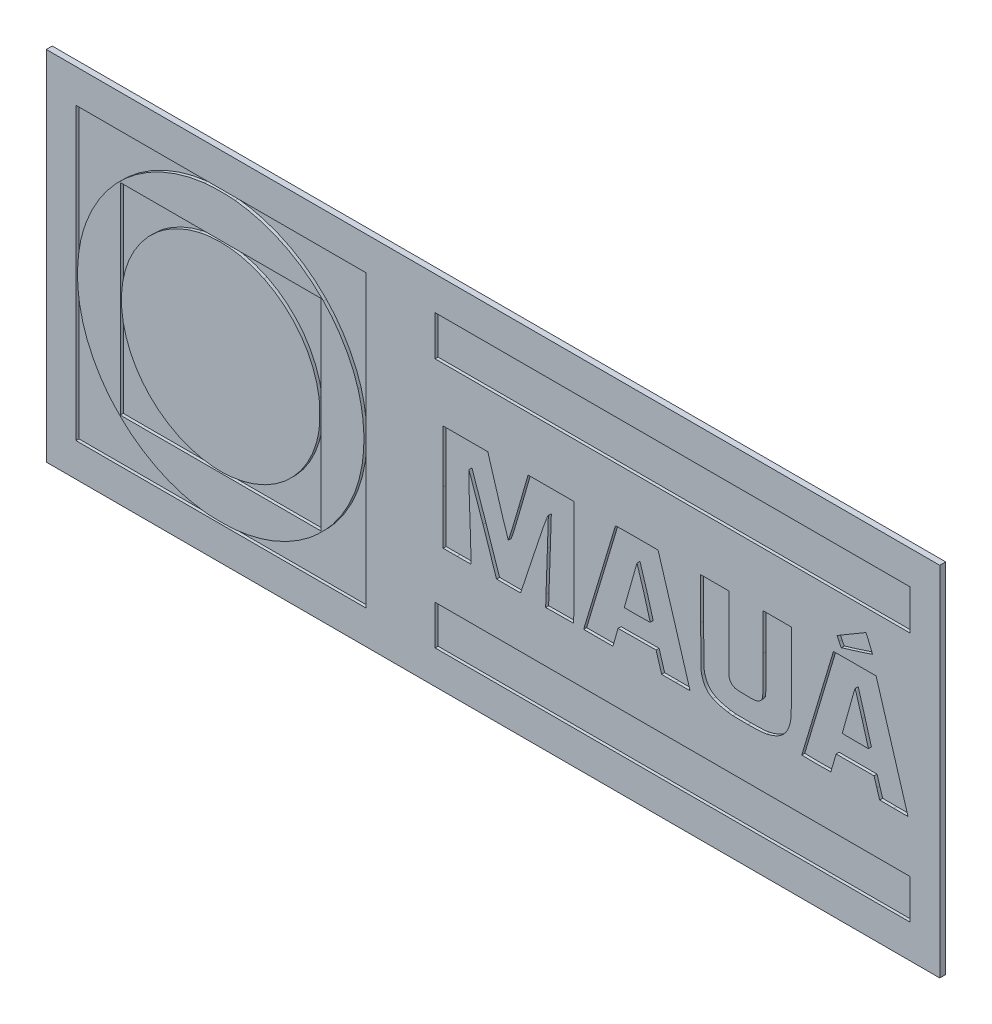
from build123d import *

# Parameters (mm, degrees)
SKETCH2_W           = 150
SKETCH2_H           = 60
BOSS_EXTRUDE1_DEPTH = 1
CUT_EXTRUDE1_DEPTH  = 0.5


with BuildPart() as part:
    # Sketch2 → Boss-Extrude1 (new body)
    with BuildSketch(Plane.XY):
        Rectangle(SKETCH2_W, SKETCH2_H)
    extrude(amount=-BOSS_EXTRUDE1_DEPTH)

    # Model → Cut-Extrude1 (cut)
    # profile 1 of 9: a face of its own
    with BuildSketch(Plane.XY):
        Polygon((-69.999501, 0.0001), (-69.999501, 24.373671), (-45.665422, 24.373671), (-21.331363, 24.373671), (-21.331363, 0.0001), (-21.331363, -24.373478), (-45.665422, -24.373478), (-69.999501, -24.373478), align=None)
        with BuildLine():
            add(Edge.make_bspline(
                [(-43.441856, -23.976498), (-38.737075, -23.511734), (-34.41055, -21.750496), (-30.68278, -18.782646)],
                knots=[0, 0, 0, 0, 1, 1, 1, 1], degree=3))
            add(Edge.make_bspline(
                [(-30.68278, -18.782646), (-29.615329, -17.932805), (-27.811508, -16.135746), (-26.977898, -15.091663)],
                knots=[0, 0, 0, 0, 1, 1, 1, 1], degree=3))
            add(Edge.make_bspline(
                [(-26.977898, -15.091663), (-22.016527, -8.877577), (-20.427734, -0.852189), (-22.64688, 6.785351)],
                knots=[0, 0, 0, 0, 1, 1, 1, 1], degree=3))
            add(Edge.make_bspline(
                [(-22.64688, 6.785351), (-23.67956, 10.339459), (-25.776242, 13.906376), (-28.467317, 16.687166)],
                knots=[0, 0, 0, 0, 1, 1, 1, 1], degree=3))
            add(Edge.make_bspline(
                [(-28.467317, 16.687166), (-32.418872, 20.770453), (-37.560455, 23.273732), (-43.295225, 23.906398)],
                knots=[0, 0, 0, 0, 1, 1, 1, 1], degree=3))
            add(Edge.make_bspline(
                [(-43.295225, 23.906398), (-44.51303, 24.040753), (-47.160051, 24.018525), (-48.470168, 23.86301)],
                knots=[0, 0, 0, 0, 1, 1, 1, 1], degree=3))
            add(Edge.make_bspline(
                [(-48.470168, 23.86301), (-55.755439, 22.997911), (-62.204067, 18.901758), (-66.136774, 12.641225)],
                knots=[0, 0, 0, 0, 1, 1, 1, 1], degree=3))
            add(Edge.make_bspline(
                [(-66.136774, 12.641225), (-67.547414, 10.395595), (-68.635085, 7.754055), (-69.210976, 5.175086)],
                knots=[0, 0, 0, 0, 1, 1, 1, 1], degree=3))
            add(Edge.make_bspline(
                [(-69.210976, 5.175086), (-69.851931, 2.304802), (-69.935669, -1.146762), (-69.435244, -4.068698)],
                knots=[0, 0, 0, 0, 1, 1, 1, 1], degree=3))
            add(Edge.make_bspline(
                [(-69.435244, -4.068698), (-68.755604, -8.03704), (-67.074459, -11.781229), (-64.529268, -14.995158)],
                knots=[0, 0, 0, 0, 1, 1, 1, 1], degree=3))
            add(Edge.make_bspline(
                [(-64.529268, -14.995158), (-63.730773, -16.003465), (-61.747419, -17.99231), (-60.755715, -18.779165)],
                knots=[0, 0, 0, 0, 1, 1, 1, 1], degree=3))
            add(Edge.make_bspline(
                [(-60.755715, -18.779165), (-57.17894, -21.617121), (-52.952281, -23.40521), (-48.667691, -23.89301)],
                knots=[0, 0, 0, 0, 1, 1, 1, 1], degree=3))
            add(Edge.make_bspline(
                [(-48.667691, -23.89301), (-48.254867, -23.940036), (-47.810455, -23.990891), (-47.680093, -24.006093)],
                knots=[0, 0, 0, 0, 1, 1, 1, 1], degree=3))
            add(Edge.make_bspline(
                [(-47.680093, -24.006093), (-47.12223, -24.071135), (-44.192335, -24.050699), (-43.441856, -23.976498)],
                knots=[0, 0, 0, 0, 1, 1, 1, 1], degree=3))
        make_face(mode=Mode.SUBTRACT)
    # profile 2 of 9: a face of its own
    with BuildSketch(Plane.XY):
        Polygon((-62.572862, -0.039402), (-62.572862, 16.868036), (-45.704934, 16.868036), (-28.836996, 16.868036), (-28.836996, -0.039402), (-28.836996, -16.946842), (-45.704934, -16.946842), (-62.572862, -16.946842), align=None)
        with BuildLine():
            add(Edge.make_bspline(
                [(-44.073449, -16.627499), (-36.462378, -15.861637), (-30.251039, -9.894933), (-29.196791, -2.336327)],
                knots=[0, 0, 0, 0, 1, 1, 1, 1], degree=3))
            add(Edge.make_bspline(
                [(-29.196791, -2.336327), (-29.039388, -1.207816), (-29.037248, 1.143196), (-29.192158, 2.236272)],
                knots=[0, 0, 0, 0, 1, 1, 1, 1], degree=3))
            add(Edge.make_bspline(
                [(-29.192158, 2.236272), (-29.97801, 7.764711), (-33.411974, 12.483206), (-38.435841, 14.937696)],
                knots=[0, 0, 0, 0, 1, 1, 1, 1], degree=3))
            add(Edge.make_bspline(
                [(-38.435841, 14.937696), (-41.834586, 16.598202), (-45.608449, 17.047045), (-49.338766, 16.234438)],
                knots=[0, 0, 0, 0, 1, 1, 1, 1], degree=3))
            add(Edge.make_bspline(
                [(-49.338766, 16.234438), (-51.740042, 15.711351), (-54.418537, 14.396102), (-56.322917, 12.804947)],
                knots=[0, 0, 0, 0, 1, 1, 1, 1], degree=3))
            add(Edge.make_bspline(
                [(-56.322917, 12.804947), (-63.816385, 6.543971), (-64.452115, -4.559637), (-57.71823, -11.565325)],
                knots=[0, 0, 0, 0, 1, 1, 1, 1], degree=3))
            add(Edge.make_bspline(
                [(-57.71823, -11.565325), (-54.173203, -15.253437), (-49.104918, -17.13375), (-44.073449, -16.627499)],
                knots=[0, 0, 0, 0, 1, 1, 1, 1], degree=3))
        make_face(mode=Mode.SUBTRACT)
    # profile 3 of 9: a face of its own
    with BuildSketch(Plane.XY):
        Polygon((-9.717374, -21.055195), (-9.717374, -17.736912), (30.141512, -17.736912), (70.000392, -17.736912), (70.000392, -21.055195), (70.000392, -24.373478), (30.141512, -24.373478), (-9.717374, -24.373478), align=None)
    # profile 4 of 9: a face of its own
    with BuildSketch(Plane.XY):
        with BuildLine():
            Line((34.860914, 1.599985), (34.835252, 8.572331))
            Line((34.835252, 8.572331), (37.209044, 8.572331))
            Line((37.209044, 8.572331), (39.582849, 8.572331))
            Line((39.582849, 8.572331), (39.582849, 2.382098))
            add(Edge.make_bspline(
                [(39.582849, 2.382098), (39.582849, -2.084243), (39.608227, -3.882934), (39.673922, -4.076705)],
                knots=[0, 0, 0, 0, 1, 1, 1, 1], degree=3))
            add(Edge.make_bspline(
                [(39.673922, -4.076705), (39.820819, -4.509806), (40.033115, -4.754072), (40.432708, -4.949759)],
                knots=[0, 0, 0, 0, 1, 1, 1, 1], degree=3))
            add(Edge.make_bspline(
                [(40.432708, -4.949759), (40.776915, -5.118322), (40.930521, -5.135624), (42.31933, -5.162265)],
                knots=[0, 0, 0, 0, 1, 1, 1, 1], degree=3))
            add(Edge.make_bspline(
                [(42.31933, -5.162265), (43.536587, -5.185633), (43.916022, -5.166898), (44.266356, -5.064777)],
                knots=[0, 0, 0, 0, 1, 1, 1, 1], degree=3))
            add(Edge.make_bspline(
                [(44.266356, -5.064777), (44.769, -4.918657), (45.135838, -4.561381), (45.266562, -4.090658)],
                knots=[0, 0, 0, 0, 1, 1, 1, 1], degree=3))
            add(Edge.make_bspline(
                [(45.266562, -4.090658), (45.321156, -3.894175), (45.349617, -1.680196), (45.349898, 2.390055)],
                knots=[0, 0, 0, 0, 1, 1, 1, 1], degree=3))
            Line((45.349898, 2.390055), (45.350149, 8.572331))
            Line((45.350149, 8.572331), (47.720346, 8.572331))
            Line((47.720346, 8.572331), (50.090549, 8.572331))
            Line((50.090549, 8.572331), (50.090549, 2.10413))
            add(Edge.make_bspline(
                [(50.090549, 2.10413), (50.090549, -3.294732), (50.070953, -4.476587), (49.971868, -5.044622)],
                knots=[0, 0, 0, 0, 1, 1, 1, 1], degree=3))
            add(Edge.make_bspline(
                [(49.971868, -5.044622), (49.570122, -7.348474), (48.398897, -8.512367), (45.941392, -9.049897)],
                knots=[0, 0, 0, 0, 1, 1, 1, 1], degree=3))
            add(Edge.make_bspline(
                [(45.941392, -9.049897), (45.249089, -9.201331), (44.867625, -9.225329), (42.821938, -9.246235)],
                knots=[0, 0, 0, 0, 1, 1, 1, 1], degree=3))
            add(Edge.make_bspline(
                [(42.821938, -9.246235), (41.540048, -9.259324), (40.402353, -9.255603), (40.29372, -9.236868)],
                knots=[0, 0, 0, 0, 1, 1, 1, 1], degree=3))
            add(Edge.make_bspline(
                [(40.29372, -9.236868), (40.185239, -9.21928), (39.776377, -9.16492), (39.385296, -9.116405)],
                knots=[0, 0, 0, 0, 1, 1, 1, 1], degree=3))
            add(Edge.make_bspline(
                [(39.385296, -9.116405), (38.507366, -9.007496), (37.516175, -8.72689), (36.886268, -8.408911)],
                knots=[0, 0, 0, 0, 1, 1, 1, 1], degree=3))
            add(Edge.make_bspline(
                [(36.886268, -8.408911), (35.942195, -7.932339), (35.406578, -7.22279), (35.060087, -5.989708)],
                knots=[0, 0, 0, 0, 1, 1, 1, 1], degree=3))
            add(Edge.make_bspline(
                [(35.060087, -5.989708), (34.888413, -5.378746), (34.886344, -5.300149), (34.860914, 1.599985)],
                knots=[0, 0, 0, 0, 1, 1, 1, 1], degree=3))
        make_face()
    # profile 5 of 9: a face of its own
    with BuildSketch(Plane.XY):
        with BuildLine():
            Line((-8.374267, -0.315929), (-8.374267, 8.572331))
            Line((-8.374267, 8.572331), (-4.625173, 8.572331))
            Line((-4.625173, 8.572331), (-0.87609, 8.572331))
            Line((-0.87609, 8.572331), (-0.716555, 8.039038))
            add(Edge.make_bspline(
                [(-0.716555, 8.039038), (1.260565, 1.429938), (2.499683, -2.56762), (2.571185, -2.56762)],
                knots=[0, 0, 0, 0, 1, 1, 1, 1], degree=3))
            add(Edge.make_bspline(
                [(2.571185, -2.56762), (2.621759, -2.56762), (3.361339, -0.145391), (4.271842, 3.002351)],
                knots=[0, 0, 0, 0, 1, 1, 1, 1], degree=3))
            Line((4.271842, 3.002351), (5.883005, 8.572331))
            Line((5.883005, 8.572331), (9.736639, 8.572331))
            Line((9.736639, 8.572331), (13.59028, 8.572331))
            Line((13.59028, 8.572331), (13.570229, -0.296177))
            Line((13.570229, -0.296177), (13.550178, -9.164674))
            Line((13.550178, -9.164674), (11.193141, -9.185561))
            Line((11.193141, -9.185561), (8.836108, -9.206447))
            Line((8.836108, -9.206447), (8.897414, -7.249849))
            add(Edge.make_bspline(
                [(8.897414, -7.249849), (8.931192, -6.173712), (9.036447, -3.124513), (9.131393, -0.473831)],
                knots=[0, 0, 0, 0, 1, 1, 1, 1], degree=3))
            add(Edge.make_bspline(
                [(9.131393, -0.473831), (9.226319, 2.176845), (9.296483, 4.354459), (9.2873, 4.36533)],
                knots=[0, 0, 0, 0, 1, 1, 1, 1], degree=3))
            add(Edge.make_bspline(
                [(9.2873, 4.36533), (9.181128, 4.490922), (8.808179, 3.443523), (6.874988, -2.409493)],
                knots=[0, 0, 0, 0, 1, 1, 1, 1], degree=3))
            Line((6.874988, -2.409493), (4.630819, -9.20408))
            Line((4.630819, -9.20408), (2.611931, -9.203067))
            Line((2.611931, -9.203067), (0.593042, -9.202055))
            Line((0.593042, -9.202055), (-1.68793, -2.40832))
            add(Edge.make_bspline(
                [(-1.68793, -2.40832), (-2.942481, 1.328225), (-4.002428, 4.385401), (-4.043388, 4.385401)],
                knots=[0, 0, 0, 0, 1, 1, 1, 1], degree=3))
            add(Edge.make_bspline(
                [(-4.043388, 4.385401), (-4.123177, 4.385401), (-4.112445, 3.97159), (-3.821682, -4.18549)],
                knots=[0, 0, 0, 0, 1, 1, 1, 1], degree=3))
            add(Edge.make_bspline(
                [(-3.821682, -4.18549), (-3.724151, -6.922343), (-3.65382, -9.171067), (-3.665415, -9.182667)],
                knots=[0, 0, 0, 0, 1, 1, 1, 1], degree=3))
            add(Edge.make_bspline(
                [(-3.665415, -9.182667), (-3.67696, -9.194212), (-4.741228, -9.203756), (-6.030357, -9.203756)],
                knots=[0, 0, 0, 0, 1, 1, 1, 1], degree=3))
            Line((-6.030357, -9.203756), (-8.374227, -9.203756))
            Line((-8.374227, -9.203756), (-8.374267, -0.315929))
        make_face()
    # profile 6 of 9: a face of its own
    with BuildSketch(Plane.XY):
        with BuildLine():
            Line((24.150435, 8.572313), (27.705997, 8.572313))
            Line((27.705997, 8.572313), (30.40354, -0.291207))
            add(Edge.make_bspline(
                [(30.40354, -0.291207), (31.887179, -5.166136), (33.089934, -9.165854), (33.076324, -9.179469)],
                knots=[0, 0, 0, 0, 1, 1, 1, 1], degree=3))
            add(Edge.make_bspline(
                [(33.076324, -9.179469), (33.062703, -9.19309), (31.984154, -9.204179), (30.679508, -9.204179)],
                knots=[0, 0, 0, 0, 1, 1, 1, 1], degree=3))
            Line((30.679508, -9.204179), (28.307412, -9.204179))
            Line((28.307412, -9.204179), (27.841843, -7.663412))
            Line((27.841843, -7.663412), (27.376278, -6.122663))
            Line((27.376278, -6.122663), (24.184494, -6.142537))
            Line((24.184494, -6.142537), (20.992709, -6.16241))
            Line((20.992709, -6.16241), (20.558874, -7.683286))
            Line((20.558874, -7.683286), (20.125055, -9.204171))
            Line((20.125055, -9.204171), (17.67702, -9.204171))
            Line((17.67702, -9.204171), (15.228991, -9.204171))
            Line((15.228991, -9.204171), (15.275661, -8.986911))
            add(Edge.make_bspline(
                [(15.275661, -8.986911), (15.347237, -8.653673), (20.517202, 8.494666), (20.558548, 8.536016)],
                knots=[0, 0, 0, 0, 1, 1, 1, 1], degree=3))
            add(Edge.make_bspline(
                [(20.558548, 8.536016), (20.578548, 8.555966), (22.194872, 8.572313), (24.150435, 8.572313)],
                knots=[0, 0, 0, 0, 1, 1, 1, 1], degree=3))
        make_face()
        with BuildLine():
            add(Edge.make_bspline(
                [(26.388688, -2.587431), (26.388688, -2.369682), (24.209905, 4.994085), (24.168388, 4.916673)],
                knots=[0, 0, 0, 0, 1, 1, 1, 1], degree=3))
            add(Edge.make_bspline(
                [(24.168388, 4.916673), (24.119209, 4.824945), (22.043325, -2.525379), (22.043325, -2.607866)],
                knots=[0, 0, 0, 0, 1, 1, 1, 1], degree=3))
            add(Edge.make_bspline(
                [(22.043325, -2.607866), (22.043325, -2.629158), (23.021031, -2.646594), (24.216006, -2.646594)],
                knots=[0, 0, 0, 0, 1, 1, 1, 1], degree=3))
            add(Edge.make_bspline(
                [(24.216006, -2.646594), (25.410981, -2.646594), (26.388688, -2.620011), (26.388688, -2.587431)],
                knots=[0, 0, 0, 0, 1, 1, 1, 1], degree=3))
        make_face(mode=Mode.SUBTRACT)
    # profile 7 of 9: a face of its own
    with BuildSketch(Plane.XY):
        with BuildLine():
            Line((60.740724, 8.57231), (64.306479, 8.57231))
            Line((64.306479, 8.57231), (64.581654, 7.683481))
            add(Edge.make_bspline(
                [(64.581654, 7.683481), (65.948384, 3.269051), (69.691558, -9.144352), (69.664215, -9.171692)],
                knots=[0, 0, 0, 0, 1, 1, 1, 1], degree=3))
            add(Edge.make_bspline(
                [(69.664215, -9.171692), (69.644974, -9.190933), (68.566458, -9.197176), (67.26742, -9.185692)],
                knots=[0, 0, 0, 0, 1, 1, 1, 1], degree=3))
            Line((67.26742, -9.185692), (64.905534, -9.164705))
            Line((64.905534, -9.164705), (64.437481, -7.643829))
            Line((64.437481, -7.643829), (63.969444, -6.122959))
            Line((63.969444, -6.122959), (60.786237, -6.122959))
            Line((60.786237, -6.122959), (57.603037, -6.122959))
            Line((57.603037, -6.122959), (57.44649, -6.656249))
            add(Edge.make_bspline(
                [(57.44649, -6.656249), (57.360361, -6.949556), (57.164084, -7.630244), (57.010253, -8.168883)],
                knots=[0, 0, 0, 0, 1, 1, 1, 1], degree=3))
            add(Edge.make_bspline(
                [(57.010253, -8.168883), (56.856432, -8.707525), (56.717978, -9.160831), (56.702583, -9.176221)],
                knots=[0, 0, 0, 0, 1, 1, 1, 1], degree=3))
            add(Edge.make_bspline(
                [(56.702583, -9.176221), (56.660777, -9.218027), (51.828854, -9.210106), (51.828854, -9.167867)],
                knots=[0, 0, 0, 0, 1, 1, 1, 1], degree=3))
            add(Edge.make_bspline(
                [(51.828854, -9.167867), (51.828854, -9.097313), (57.113602, 8.510957), (57.143977, 8.541332)],
                knots=[0, 0, 0, 0, 1, 1, 1, 1], degree=3))
            add(Edge.make_bspline(
                [(57.143977, 8.541332), (57.161015, 8.558421), (58.779561, 8.57231), (60.740724, 8.57231)],
                knots=[0, 0, 0, 0, 1, 1, 1, 1], degree=3))
        make_face()
        with BuildLine():
            Line((60.817923, -2.646624), (63.029325, -2.646624))
            Line((63.029325, -2.646624), (61.936697, 1.154636))
            add(Edge.make_bspline(
                [(61.936697, 1.154636), (61.33575, 3.245334), (60.827686, 4.97229), (60.807652, 4.99232)],
                knots=[0, 0, 0, 0, 1, 1, 1, 1], degree=3))
            add(Edge.make_bspline(
                [(60.807652, 4.99232), (60.765378, 5.03459), (60.80664, 5.176043), (59.606576, 0.869169)],
                knots=[0, 0, 0, 0, 1, 1, 1, 1], degree=3))
            add(Edge.make_bspline(
                [(59.606576, 0.869169), (59.098064, -0.955885), (58.665024, -2.49355), (58.644262, -2.547868)],
                knots=[0, 0, 0, 0, 1, 1, 1, 1], degree=3))
            add(Edge.make_bspline(
                [(58.644262, -2.547868), (58.614596, -2.625411), (59.08134, -2.646624), (60.817923, -2.646624)],
                knots=[0, 0, 0, 0, 1, 1, 1, 1], degree=3))
        make_face(mode=Mode.SUBTRACT)
    # profile 8 of 9: a face of its own
    with BuildSketch(Plane.XY):
        with BuildLine():
            Line((58.091354, 10.469239), (57.766228, 11.181057))
            Line((57.766228, 11.181057), (59.083644, 11.95879))
            add(Edge.make_bspline(
                [(59.083644, 11.95879), (62.237067, 13.820376), (62.59506, 14.028388), (62.60863, 14.006937)],
                knots=[0, 0, 0, 0, 1, 1, 1, 1], degree=3))
            add(Edge.make_bspline(
                [(62.60863, 14.006937), (62.770955, 13.750289), (63.736613, 11.443516), (63.696648, 11.407907)],
                knots=[0, 0, 0, 0, 1, 1, 1, 1], degree=3))
            add(Edge.make_bspline(
                [(63.696648, 11.407907), (63.639725, 11.357235), (58.576058, 9.757432), (58.472486, 9.757432)],
                knots=[0, 0, 0, 0, 1, 1, 1, 1], degree=3))
            add(Edge.make_bspline(
                [(58.472486, 9.757432), (58.441686, 9.757432), (58.270173, 10.07775), (58.091354, 10.469239)],
                knots=[0, 0, 0, 0, 1, 1, 1, 1], degree=3))
        make_face()
    # profile 9 of 9: a face of its own
    with BuildSketch(Plane.XY):
        Polygon((-9.717374, 21.015891), (-9.717374, 24.373671), (30.141512, 24.373671), (70.000392, 24.373671), (70.000392, 21.015891), (70.000392, 17.658098), (30.141512, 17.658098), (-9.717374, 17.658098), align=None)
    extrude(amount=-CUT_EXTRUDE1_DEPTH, mode=Mode.SUBTRACT)


solid = part.part
